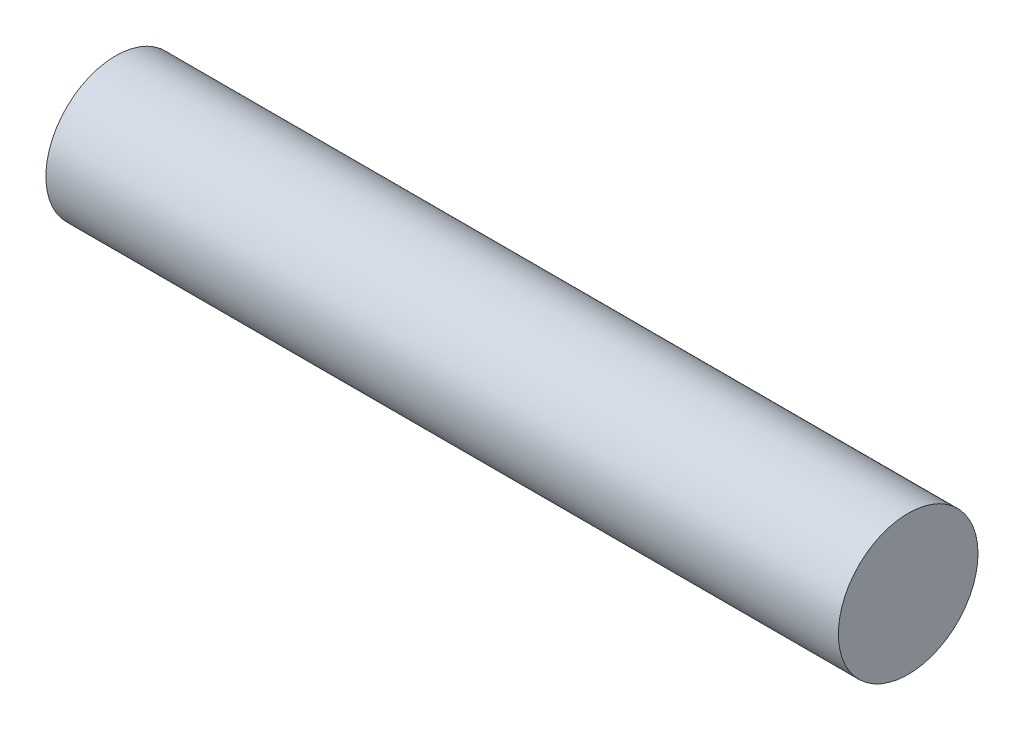
from build123d import *

# Parameters (mm, degrees)
BOSS_EXTRUDE1_DEPTH      = 79.074518
BOSS_EXTRUDE1_DEPTH_BACK = 79.074518
SKETCH1_R                = 13.935202


with BuildPart() as part:
    # Sketch1 → Boss-Extrude1 (new, two sides: drawn at the far end of the back side and taken through both)
    with BuildSketch(Plane(origin=(0, 0, 0), x_dir=(0, 0, -1), z_dir=(1, 0, 0)).offset(-BOSS_EXTRUDE1_DEPTH_BACK)):
        Circle(SKETCH1_R)
    extrude(amount=BOSS_EXTRUDE1_DEPTH + BOSS_EXTRUDE1_DEPTH_BACK)


solid = part.part
